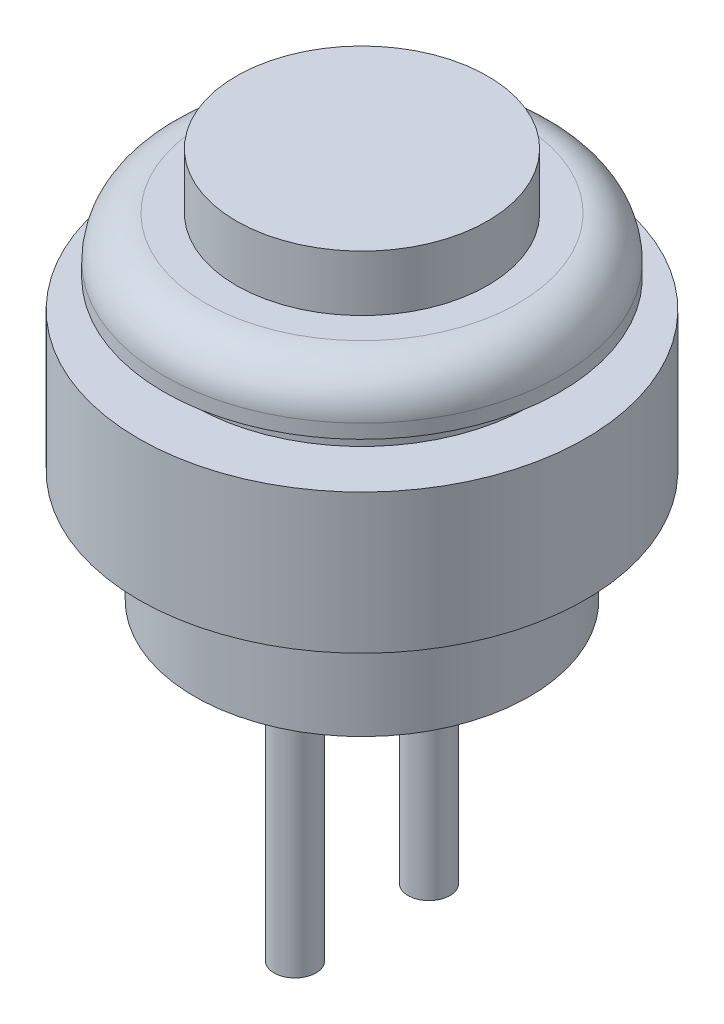
from build123d import *

# Parameters (mm, degrees)
SKETCH_1_R      = 7.1
EXTRUDE_1_DEPTH = 2
FILLET_1_R      = 1.5
SKETCH_2_R      = 4.5
EXTRUDE_2_DEPTH = 2
SKETCH_3_R      = 6
EXTRUDE_3_DEPTH = 10
SKETCH_4_R      = 0.75
EXTRUDE_4_DEPTH = 10
SKETCH_5_R      = 8
SKETCH_5_R_2    = 6
EXTRUDE_5_DEPTH = 5


with BuildPart() as part:
    # 草图1 → 拉伸1 (new body)
    with BuildSketch(Plane(origin=(0, 0, 0), x_dir=(1, 0, 0), z_dir=(0, 1, 0))):
        with Locations(Location((0, 0, 0), (0, 0, 270))):
            Circle(SKETCH_1_R)
    extrude(amount=EXTRUDE_1_DEPTH)

    # 圆角1
    fillet_1_edges = [part.edges().sort_by_distance(p)[0] for p in [
        (0, 2, -7.1),
    ]]
    fillet(fillet_1_edges, radius=FILLET_1_R)

    # 草图2 → 拉伸2 (add)
    with BuildSketch(Plane(origin=(0, 2, 0), x_dir=(-1, 0, 0), z_dir=(0, 1, 0))):
        with Locations(Location((0, 0, 0), (0, 0, 90))):
            Circle(SKETCH_2_R)
    extrude(amount=EXTRUDE_2_DEPTH)

    # 草图3 → 拉伸3 (add)
    with BuildSketch(Plane.XZ):
        with Locations(Location((0, 0, 0), (0, 0, 90))):
            Circle(SKETCH_3_R)
    extrude(amount=EXTRUDE_3_DEPTH)

    # 草图4 → 拉伸4 (add)
    with BuildSketch(Plane.XZ.offset(10)):
        with Locations(Location((0, -2.4, 0), (0, 0, 270))):
            Circle(SKETCH_4_R)
        with Locations(Location((0, 2.4, 0), (0, 0, 270))):
            Circle(SKETCH_4_R)
    extrude(amount=EXTRUDE_4_DEPTH)

    # 草图5 → 拉伸5 (add)
    with BuildSketch(Plane.XZ.offset(1)):
        with Locations(Location((0, 0, 0), (0, 0, 270))):
            Circle(SKETCH_5_R)
        with Locations(Location((0, 0, 0), (0, 0, 90))):
            Circle(SKETCH_5_R_2, mode=Mode.SUBTRACT)
    extrude(amount=EXTRUDE_5_DEPTH)


solid = part.part
